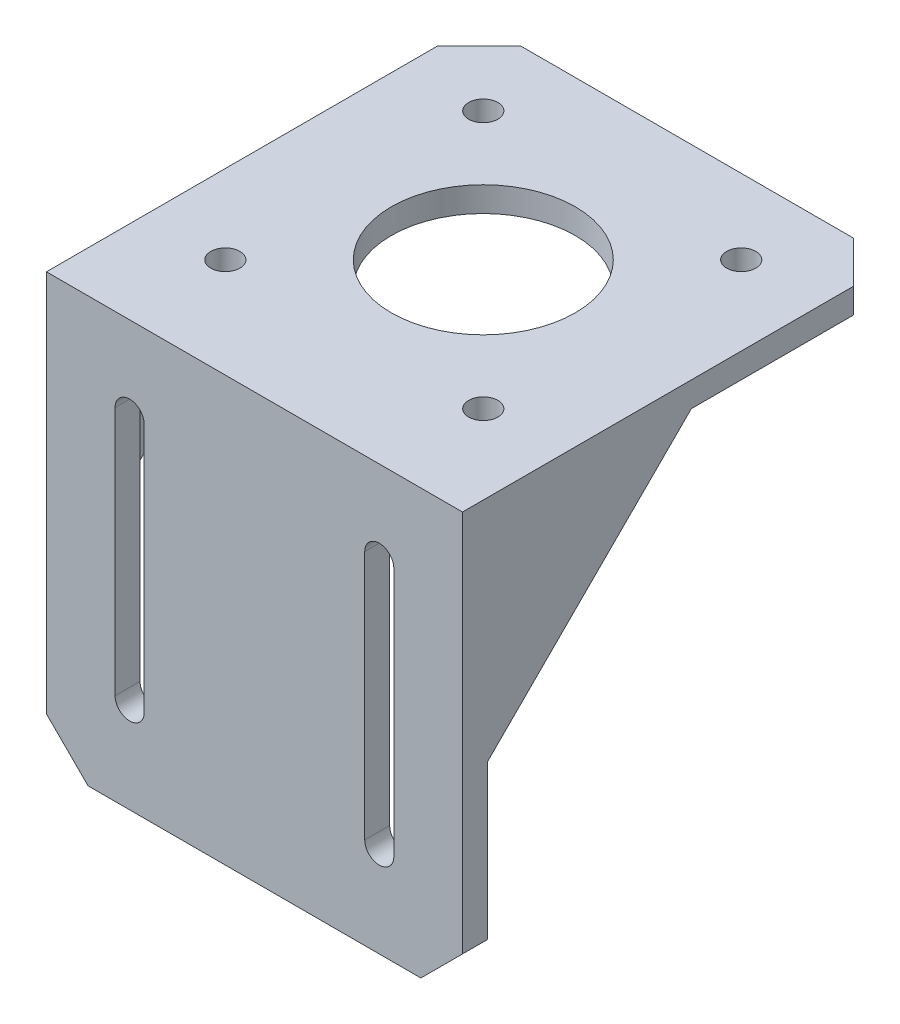
from build123d import *

# Parameters (mm, degrees)
SKETCH_1_R      = 11.05
SKETCH_1_R_2    = 1.75
EXTRUDE_1_DEPTH = 3
EXTRUDE_2_DEPTH = 3
EXTRUDE_3_DEPTH = 3


with BuildPart() as part:
    # 草图1 → 凸台-拉伸1 (new body)
    with BuildSketch(Plane(origin=(0, 0, 0), x_dir=(1, 0, 0), z_dir=(0, 1, 0))):
        Polygon((-25, 19.5), (-20, 24.5), (20, 24.5), (25, 19.5), (25, -24.5), (-25, -24.5), align=None)
        with Locations(Location((0, 0, 0), (0, 0, 270))):
            Circle(SKETCH_1_R, mode=Mode.SUBTRACT)
        with Locations(Location((15.5, 15.5, 0), (0, 0, 270))):
            Circle(SKETCH_1_R_2, mode=Mode.SUBTRACT)
        with Locations(Location((15.5, -15.5, 0), (0, 0, 270))):
            Circle(SKETCH_1_R_2, mode=Mode.SUBTRACT)
        with Locations(Location((-15.5, -15.5, 0), (0, 0, 270))):
            Circle(SKETCH_1_R_2, mode=Mode.SUBTRACT)
        with Locations(Location((-15.5, 15.5, 0), (0, 0, 270))):
            Circle(SKETCH_1_R_2, mode=Mode.SUBTRACT)
    extrude(amount=EXTRUDE_1_DEPTH)

    # 草图3 → 凸台-拉伸2 (add)
    with BuildSketch(Plane.XY.offset(24.5)):
        Polygon((-25, 3), (25, 3), (25, -43), (20, -48), (-20, -48), (-25, -43), align=None)
        with BuildLine():
            Line((-13.25, -7), (-13.25, -37))
            ThreePointArc((-13.25, -37), (-15, -38.75), (-16.75, -37))
            Line((-16.75, -37), (-16.75, -7))
            ThreePointArc((-16.75, -7), (-15, -5.25), (-13.25, -7))
        make_face(mode=Mode.SUBTRACT)
        with BuildLine():
            Line((13.25, -7), (13.25, -37))
            ThreePointArc((13.25, -37), (15, -38.75), (16.75, -37))
            Line((16.75, -37), (16.75, -7))
            ThreePointArc((16.75, -7), (15, -5.25), (13.25, -7))
        make_face(mode=Mode.SUBTRACT)
    extrude(amount=EXTRUDE_2_DEPTH)

    # 草图4 → 凸台-拉伸3 (add)
    with BuildSketch(Plane(origin=(25, 0, 0), x_dir=(0, 0, -1), z_dir=(1, 0, 0))):
        Polygon((-24.5, 0), (0, 0), (-24.5, -24.5), align=None)
    extrude_3 = extrude(amount=-EXTRUDE_3_DEPTH)

    # 镜向1: 凸台-拉伸3 across plane
    add(extrude_3.mirror(Plane(origin=(0, 0, 0), x_dir=(0, 0, 1), z_dir=(1, 0, 0))))


solid = part.part
